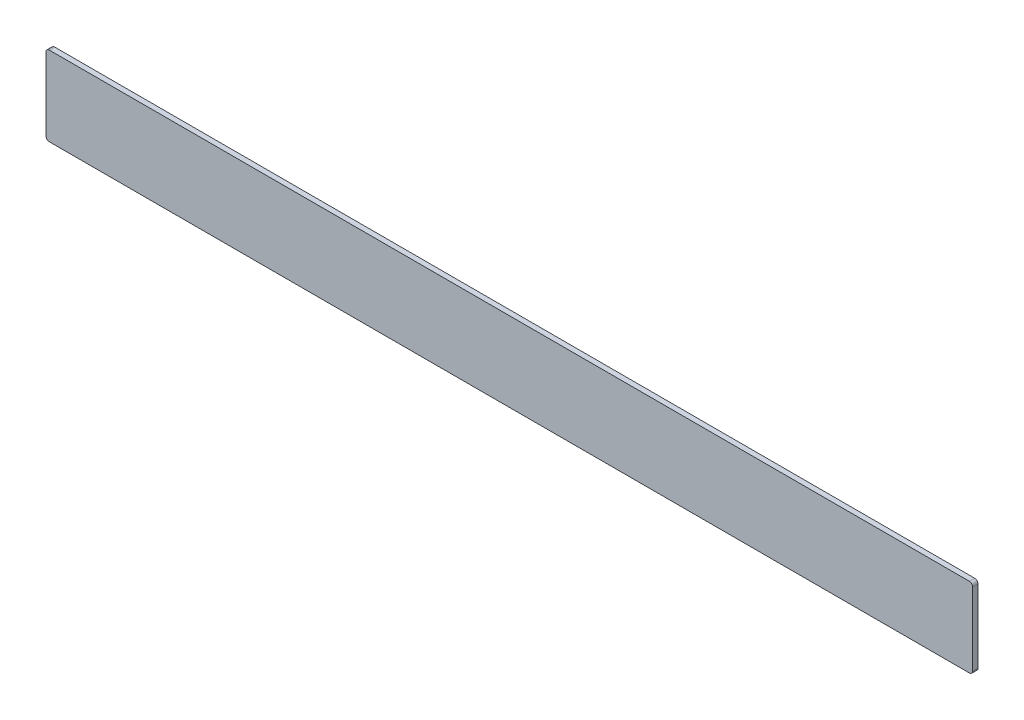
from build123d import *

# Parameters (mm, degrees)
SKETCH1_W           = 1400
SKETCH1_H           = 120
BOSS_EXTRUDE1_DEPTH = 8
FILLET1_R           = 5


with BuildPart() as part:
    # Sketch1 → Boss-Extrude1 (new body)
    with BuildSketch(Plane.XY):
        Rectangle(SKETCH1_W, SKETCH1_H)
    extrude(amount=BOSS_EXTRUDE1_DEPTH)

    # Fillet1
    fillet1_edges = [part.edges().sort_by_distance(p)[0] for p in [
        (-700, 60, 4),
        (700, 60, 4),
        (700, -60, 4),
        (-700, -60, 4),
    ]]
    fillet(fillet1_edges, radius=FILLET1_R)


solid = part.part
